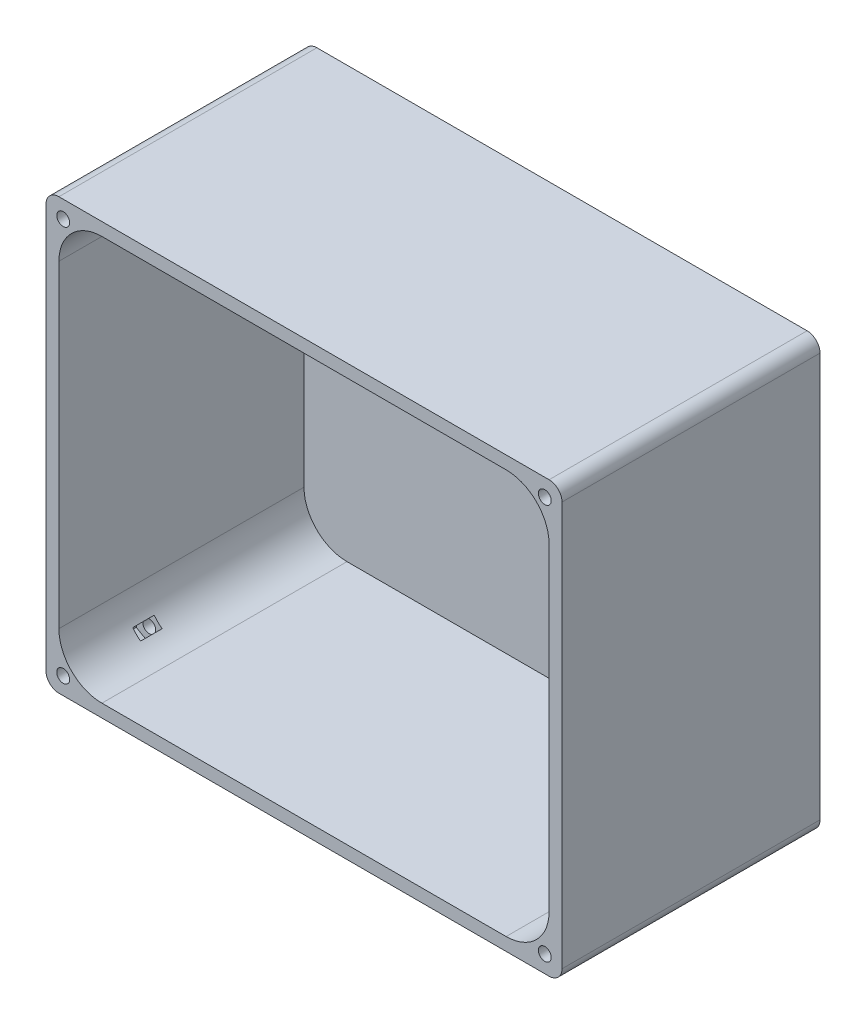
from build123d import *

# Parameters (mm, degrees)
BOSS_EXTRUDE1_DEPTH = 3
BOSS_EXTRUDE2_DEPTH = 60
SKETCH3_R           = 1.5
CUT_EXTRUDE1_DEPTH  = 30
CUT_EXTRUDE2_START  = -15
SKETCH3_3_R         = 1.5
CUT_EXTRUDE2_DEPTH  = 5


with BuildPart() as part:
    # Sketch1 → Boss-Extrude1 (new body)
    with BuildSketch(Plane(origin=(0, 0, 0), x_dir=(0, 1, 0), z_dir=(0, 0, 1))):
        with BuildLine():
            ThreePointArc((-50, -57), (-49.121320344, -59.121320344), (-47, -60))
            Line((-47, -60), (47, -60))
            ThreePointArc((47, -60), (49.121320344, -59.121320344), (50, -57))
            Line((50, -57), (50, 57))
            ThreePointArc((50, 57), (49.121320344, 59.121320344), (47, 60))
            Line((47, 60), (-47, 60))
            ThreePointArc((-47, 60), (-49.121320344, 59.121320344), (-50, 57))
            Line((-50, 57), (-50, -57))
        make_face()
    extrude(amount=BOSS_EXTRUDE1_DEPTH)

    # Sketch1<3> → Boss-Extrude2 (add)
    with BuildSketch(Plane(origin=(0, 0, 0), x_dir=(0, 1, 0), z_dir=(0, 0, 1))):
        with BuildLine():
            ThreePointArc((-50, -57), (-49.121320344, -59.121320344), (-47, -60))
            Line((-47, -60), (47, -60))
            ThreePointArc((47, -60), (49.121320344, -59.121320344), (50, -57))
            Line((50, -57), (50, 57))
            ThreePointArc((50, 57), (49.121320344, 59.121320344), (47, 60))
            Line((47, 60), (-47, 60))
            ThreePointArc((-47, 60), (-49.121320344, 59.121320344), (-50, 57))
            Line((-50, 57), (-50, -57))
        make_face()
        with BuildLine():
            Line((-47, -47), (-47, 47))
            ThreePointArc((-47, 47), (-44.071067812, 54.071067812), (-37, 57))
            Line((-37, 57), (37, 57))
            ThreePointArc((37, 57), (44.071067812, 54.071067812), (47, 47))
            Line((47, 47), (47, -47))
            ThreePointArc((47, -47), (44.071067812, -54.071067812), (37, -57))
            Line((37, -57), (-37, -57))
            ThreePointArc((-37, -57), (-44.071067812, -54.071067812), (-47, -47))
        make_face(mode=Mode.SUBTRACT)
    extrude(amount=BOSS_EXTRUDE2_DEPTH)

    # Sketch3 → Cut-Extrude1 (cut)
    with BuildSketch(Plane.XY.offset(60)):
        with Locations((-56, 46)):
            Circle(SKETCH3_R)
        with Locations((56, 46)):
            Circle(SKETCH3_R)
        with Locations((56, -46)):
            Circle(SKETCH3_R)
        with Locations((-56, -46)):
            Circle(SKETCH3_R)
    extrude(amount=-CUT_EXTRUDE1_DEPTH, mode=Mode.SUBTRACT)

    # Sketch3<3> → Cut-Extrude2 (cut)
    # profile 1 of 4: a face of its own
    with BuildSketch(Plane.XY.offset(60).offset(CUT_EXTRUDE2_START)):
        with BuildLine():
            Line((59, 47.732050808), (56, 49.464101615))
            Line((56, 49.464101615), (53, 47.732050808))
            Line((53, 47.732050808), (53, 45))
            ThreePointArc((53, 45), (53.979459017, 44.161504858), (54.842890525, 43.203955852))
            Line((54.842890525, 43.203955852), (56, 42.535898385))
            Line((56, 42.535898385), (59, 44.267949192))
            Line((59, 44.267949192), (59, 47.732050808))
        make_face()
        with Locations((56, 46)):
            Circle(SKETCH3_3_R, mode=Mode.SUBTRACT)
    # profile 2 of 4: a face of its own
    with BuildSketch(Plane.XY.offset(60).offset(CUT_EXTRUDE2_START)):
        with BuildLine():
            Line((-53, 45), (-53, 47.732050808))
            Line((-53, 47.732050808), (-56, 49.464101615))
            Line((-56, 49.464101615), (-59, 47.732050808))
            Line((-59, 47.732050808), (-59, 44.267949192))
            Line((-59, 44.267949192), (-56, 42.535898385))
            Line((-56, 42.535898385), (-54.842890525, 43.203955852))
            ThreePointArc((-54.842890525, 43.203955852), (-53.979459017, 44.161504858), (-53, 45))
        make_face()
        with Locations((-56, 46)):
            Circle(SKETCH3_3_R, mode=Mode.SUBTRACT)
    # profile 3 of 4: a face of its own
    with BuildSketch(Plane.XY.offset(60).offset(CUT_EXTRUDE2_START)):
        with BuildLine():
            Line((59, -44.267949192), (56, -42.535898385))
            Line((56, -42.535898385), (54.842890525, -43.203955852))
            ThreePointArc((54.842890525, -43.203955852), (53.979459017, -44.161504858), (53, -45))
            Line((53, -45), (53, -47.732050808))
            Line((53, -47.732050808), (56, -49.464101615))
            Line((56, -49.464101615), (59, -47.732050808))
            Line((59, -47.732050808), (59, -44.267949192))
        make_face()
        with Locations((56, -46)):
            Circle(SKETCH3_3_R, mode=Mode.SUBTRACT)
    # profile 4 of 4: a face of its own
    with BuildSketch(Plane.XY.offset(60).offset(CUT_EXTRUDE2_START)):
        with BuildLine():
            Line((-54.842890525, -43.203955852), (-56, -42.535898385))
            Line((-56, -42.535898385), (-59, -44.267949192))
            Line((-59, -44.267949192), (-59, -47.732050808))
            Line((-59, -47.732050808), (-56, -49.464101615))
            Line((-56, -49.464101615), (-53, -47.732050808))
            Line((-53, -47.732050808), (-53, -45))
            ThreePointArc((-53, -45), (-53.979459017, -44.161504858), (-54.842890525, -43.203955852))
        make_face()
        with Locations((-56, -46)):
            Circle(SKETCH3_3_R, mode=Mode.SUBTRACT)
    extrude(amount=-CUT_EXTRUDE2_DEPTH, mode=Mode.SUBTRACT)


solid = part.part
